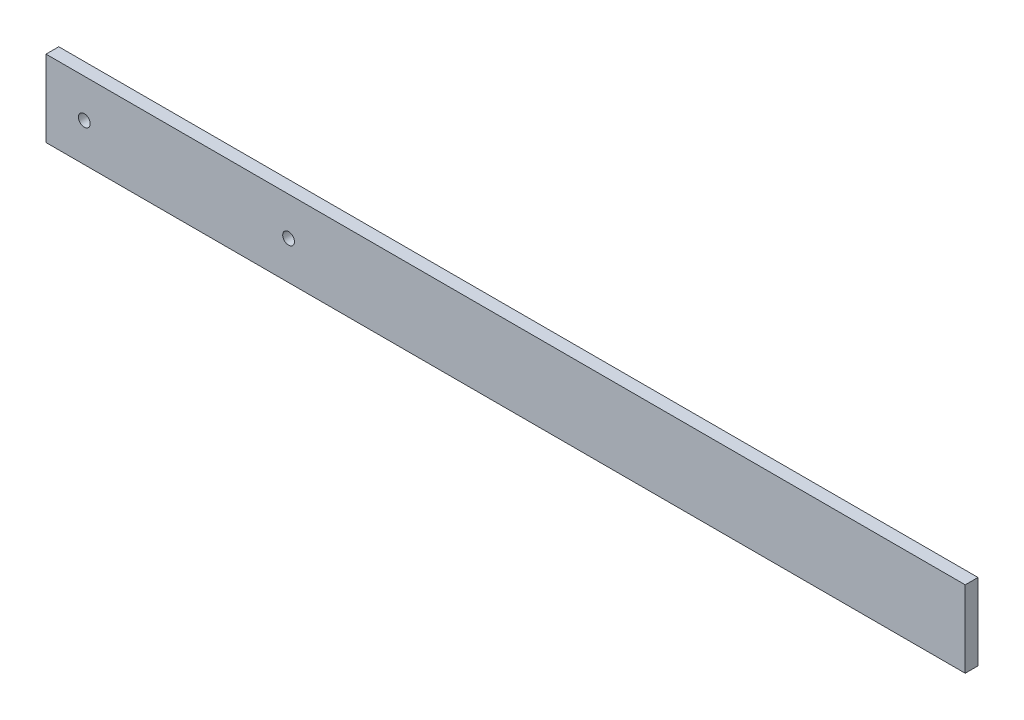
from build123d import *

# Parameters (mm, degrees)
SKETCH1_W           = 228.6
SKETCH1_H           = 19.05
BOSS_EXTRUDE1_DEPTH = 3.175
SKETCH2_R           = 1.4605
CUT_EXTRUDE1_DEPTH  = 230.414348124


with BuildPart() as part:
    # Sketch1 → Boss-Extrude1 (new body)
    with BuildSketch(Plane.XY):
        with Locations((114.3, 9.525)):
            Rectangle(SKETCH1_W, SKETCH1_H)
    extrude(amount=BOSS_EXTRUDE1_DEPTH)

    # Sketch2 → Cut-Extrude1 (cut, through all)
    with BuildSketch(Plane.XY.offset(3.175)):
        with Locations((9.525, 9.525)):
            Circle(SKETCH2_R)
        with Locations((60.325, 9.525)):
            Circle(SKETCH2_R)
    extrude(amount=-CUT_EXTRUDE1_DEPTH, mode=Mode.SUBTRACT)


solid = part.part
